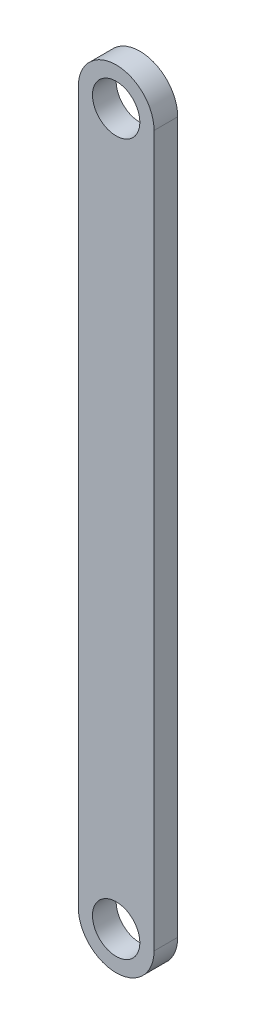
from build123d import *

# Parameters (mm, degrees)
SKETCH_1_R      = 0.5
EXTRUDE_1_DEPTH = 0.5


with BuildPart() as part:
    # 草圖1 → 填料-伸長1 (new body)
    with BuildSketch(Plane.XY):
        with BuildLine():
            Line((0.8, 11.320776031), (0.8, -3.679223969))
            ThreePointArc((0.8, -3.679223969), (0, -4.479223969), (-0.8, -3.679223969))
            Line((-0.8, -3.679223969), (-0.8, 11.320776031))
            ThreePointArc((-0.8, 11.320776031), (0, 12.120776031), (0.8, 11.320776031))
        make_face()
        with Locations((0, 11.320776031)):
            Circle(SKETCH_1_R, mode=Mode.SUBTRACT)
        with Locations((0, -3.679223969)):
            Circle(SKETCH_1_R, mode=Mode.SUBTRACT)
    extrude(amount=EXTRUDE_1_DEPTH)


solid = part.part
